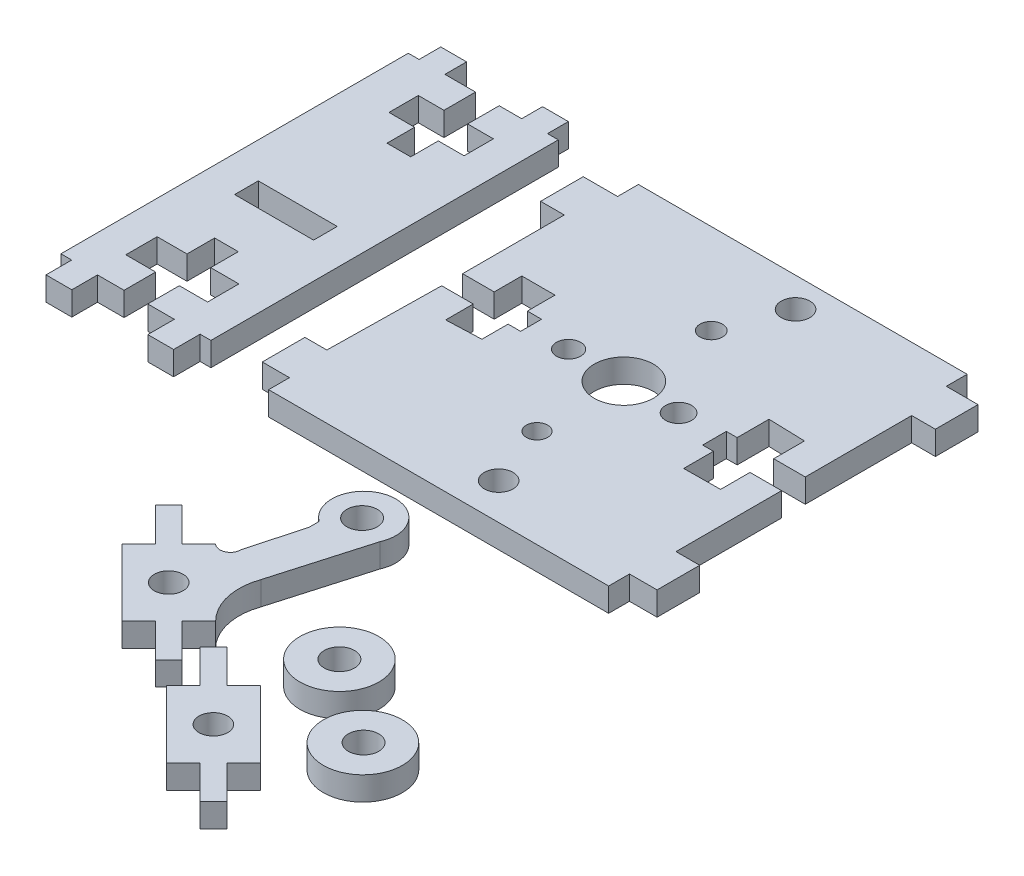
from build123d import *

# Parameters (mm, degrees)
SKETCH6_R             = 5.00001662
SKETCH6_R_2           = 1.925
BOSS_EXTRUDE1_DEPTH   = 3
SKETCH6_R_3           = 5.003976988
BOSS_EXTRUDE1_2_DEPTH = 3
SKETCH6_R_4           = 3.75
SKETCH6_R_5           = 1.53326
SKETCH6_R_6           = 1.42391285
SKETCH6_R_7           = 1.648176726
SKETCH6_R_8           = 1.82
SKETCH6_R_9           = 1.352434515
BOSS_EXTRUDE1_3_DEPTH = 3
SKETCH6_W             = 10
SKETCH6_H             = 3
BOSS_EXTRUDE1_4_DEPTH = 3
SKETCH6_R_10          = 1.820084062
BOSS_EXTRUDE1_5_DEPTH = 3
BOSS_EXTRUDE1_6_DEPTH = 3


with BuildPart() as part:
    # Sketch6 → Boss-Extrude1 (new body)
    with BuildSketch(Plane(origin=(0, 0, -6.873626876), x_dir=(1, 0, 0), z_dir=(0, 1, 0))):
        with Locations(Location((229.874784709, -56.056944562, 0), (0, 0, 270))):
            Circle(SKETCH6_R)
        with Locations(Location((229.874784709, -56.056944562, 0), (0, 0, 270))):
            Circle(SKETCH6_R_2, mode=Mode.SUBTRACT)
    extrude(amount=BOSS_EXTRUDE1_DEPTH)


with BuildPart() as body_2:
    # Sketch6 → Boss-Extrude1 2 (new body)
    with BuildSketch(Plane(origin=(0, 0, -6.873626876), x_dir=(1, 0, 0), z_dir=(0, 1, 0))):
        with Locations(Location((240.501206391, -63.709072507, 0), (0, 0, 270))):
            Circle(SKETCH6_R_3)
        with Locations(Location((240.542284709, -63.667989562, 0), (0, 0, 270))):
            Circle(SKETCH6_R_2, mode=Mode.SUBTRACT)
    extrude(amount=BOSS_EXTRUDE1_2_DEPTH)


with BuildPart() as body_3:
    # Sketch6 → Boss-Extrude1 3 (new body)
    with BuildSketch(Plane(origin=(0, 0, -6.873626876), x_dir=(1, 0, 0), z_dir=(0, 1, 0))):
        Polygon((242.382239794, 6.917708836), (239.382239794, 6.917708836), (239.382239794, -6.558967727), (235.382239794, -6.558967727), (235.382239794, -2.661698693), (230.749800061, -2.521076352), (230.749800061, -6.558967727), (229.382239794, -6.558967727), (229.382239794, -9.558967727), (230.748691654, -9.558967727), (230.748691654, -13.329897708), (235.382239794, -13.283644713), (235.382239794, -9.558967727), (239.382239794, -9.558967727), (239.382239794, -22.931889683), (242.382239794, -22.931889683), (242.382239794, -28.331889683), (238.890190267, -28.331889683), (238.890190267, -30.971594022), (195.823762638, -30.971594022), (195.823762638, -28.331889683), (192.382239794, -28.331889683), (192.382239794, -22.931889683), (195.157204069, -22.931889683), (195.382239794, -8.612742778), (199.382239794, -8.612742778), (199.382239794, -12.109207952), (203.797700047, -11.931096242), (203.797700047, -8.612742778), (205.382239794, -8.612742778), (205.382239794, -5.961471436), (203.587068887, -5.961471436), (203.587068887, -2.462294151), (199.382239794, -2.462294151), (199.382239794, -5.961471436), (195.382239794, -5.961471436), (195.382239794, 6.917708836), (192.382239794, 6.917708836), (192.382239794, 12.317708836), (196.731116236, 12.317708836), (196.731116236, 14.957413175), (238.366254708, 14.957413175), (238.366254708, 12.317708836), (242.382239794, 12.317708836), align=None)
        with Locations(Location((217.382239794, -7.542579319, 0), (0, 0, 270))):
            Circle(SKETCH6_R_4, mode=Mode.SUBTRACT)
        with Locations(Location((210.382239794, -7.542586825, 0), (0, 0, 270))):
            Circle(SKETCH6_R_5, mode=Mode.SUBTRACT)
        with Locations(Location((217.372614794, 3.539788175, 0), (0, 0, 270))):
            Circle(SKETCH6_R_6, mode=Mode.SUBTRACT)
        with Locations(Location((224.332886765, -7.554518996, 0), (0, 0, 270))):
            Circle(SKETCH6_R_7, mode=Mode.SUBTRACT)
        with Locations(Location((220.382239794, 11.207413175, 0), (0, 0, 270))):
            Circle(SKETCH6_R_8, mode=Mode.SUBTRACT)
        with Locations(Location((217.382239794, -18.536664507, 0), (0, 0, 270))):
            Circle(SKETCH6_R_9, mode=Mode.SUBTRACT)
        with Locations(Location((220.368609085, -26.382015564, 0), (0, 0, 270))):
            Circle(SKETCH6_R_8, mode=Mode.SUBTRACT)
    extrude(amount=BOSS_EXTRUDE1_3_DEPTH)


with BuildPart() as body_4:
    # Sketch6 → Boss-Extrude1 4 (new body)
    with BuildSketch(Plane(origin=(0, 0, -6.873626876), x_dir=(1, 0, 0), z_dir=(0, 1, 0))):
        Polygon((172.399287959, 17.523976804), (172.399287959, 14.779888825), (176.279351087, 14.779888825), (176.279351087, 10.779888825), (173.032045346, 10.779888825), (173.032045346, 7.062992514), (176.279351087, 7.062992514), (176.279351087, 3.562992514), (179.279351087, 3.562992514), (179.279351087, 7.062992514), (182.543927994, 7.062992514), (182.543927994, 10.779888825), (179.279351087, 10.779888825), (179.279351087, 14.779888825), (182.127695455, 14.779888825), (182.127695455, 17.421571169), (185.39570021, 17.421571169), (185.39570021, 14.779888825), (186.763491707, 14.779888825), (186.763491707, -29.220111175), (185.39570021, -29.220111175), (185.39570021, -32.578428831), (182.127695455, -32.578428831), (182.127695455, -29.220111175), (178.763491707, -29.220111175), (178.763491707, -25.220111175), (182.34039673, -25.220111175), (182.34039673, -21.252563381), (178.763491707, -21.252563381), (178.763491707, -17.752563381), (175.763491707, -17.752563381), (175.763491707, -21.252563381), (171.982778318, -21.252563381), (171.982778318, -25.220111175), (175.763491707, -25.220111175), (175.763491707, -29.220111175), (172.399287959, -29.220111175), (172.399287959, -32.476023196), (169.131283204, -32.476023196), (169.131283204, -29.220111175), (167.763491707, -29.220111175), (167.763491707, 14.779888825), (169.131283204, 14.779888825), (169.131283204, 17.523976804), align=None)
        with Locations((177.263491707, -10.220111175)):
            Rectangle(SKETCH6_W, SKETCH6_H, mode=Mode.SUBTRACT)
    extrude(amount=BOSS_EXTRUDE1_4_DEPTH)


with BuildPart() as body_5:
    # Sketch6 → Boss-Extrude1 5 (new body)
    with BuildSketch(Plane(origin=(0, 0, -6.873626876), x_dir=(1, 0, 0), z_dir=(0, 1, 0))):
        with BuildLine():
            Line((217.860134709, -59.724119562), (215.738834709, -61.845439562))
            Line((215.738834709, -61.845439562), (219.981434709, -66.088079562))
            Line((219.981434709, -66.088079562), (218.284434709, -67.785139562))
            Line((218.284434709, -67.785139562), (214.041739708, -63.542484562))
            Line((214.041739708, -63.542484562), (211.920434709, -65.663809562))
            Line((211.920434709, -65.663809562), (203.435134709, -57.178529562))
            Line((203.435134709, -57.178529562), (205.556434709, -55.057209562))
            Line((205.556434709, -55.057209562), (201.313834709, -50.814569562))
            Line((201.313834709, -50.814569562), (203.010934709, -49.117519562))
            Line((203.010934709, -49.117519562), (207.253534709, -53.360159562))
            Line((207.253534709, -53.360159562), (209.374834709, -51.238839562))
            ThreePointArc((209.374834709, -51.238839562), (210.816400769, -51.525579581), (211.632980333, -50.303478783))
            Line((211.632980333, -50.303478783), (213.474534709, -43.456719562))
            Line((213.474534709, -43.456719562), (213.474534709, -42.219932453))
            ThreePointArc((213.474534709, -42.219932453), (214.794826347, -35.039859898), (219.548340876, -40.580682177))
            Line((219.548340876, -40.580682177), (216.163084709, -52.299499562))
            ThreePointArc((216.163084709, -52.299499562), (215.942727144, -56.256124713), (217.860134709, -59.724119562))
        make_face()
        with Locations(Location((215.824034709, -39.132809562, 0), (0, 0, 270))):
            Circle(SKETCH6_R_2, mode=Mode.SUBTRACT)
        with Locations(Location((210.647634709, -58.451324562, 0), (0, 0, 270))):
            Circle(SKETCH6_R_10, mode=Mode.SUBTRACT)
    extrude(amount=BOSS_EXTRUDE1_5_DEPTH)


with BuildPart() as body_6:
    # Sketch6 → Boss-Extrude1 6 (new body)
    with BuildSketch(Plane(origin=(0, 0, -6.873626876), x_dir=(1, 0, 0), z_dir=(0, 1, 0))):
        Polygon((227.759629709, -63.966754562), (236.244954708, -72.452019563), (234.123654708, -74.573339563), (238.366254708, -78.815979563), (236.669154708, -80.513039563), (232.426554708, -76.270399563), (230.305254708, -78.391719563), (221.819934709, -69.906459562), (223.941234709, -67.785139562), (219.698634709, -63.542489562), (221.395634709, -61.845439562), (225.638334709, -66.088079562), align=None)
        with Locations(Location((229.032434709, -71.179244562, 0), (0, 0, 270))):
            Circle(SKETCH6_R_8, mode=Mode.SUBTRACT)
    extrude(amount=BOSS_EXTRUDE1_6_DEPTH)


solid = Compound([part.part, body_2.part, body_3.part, body_4.part, body_5.part, body_6.part])
